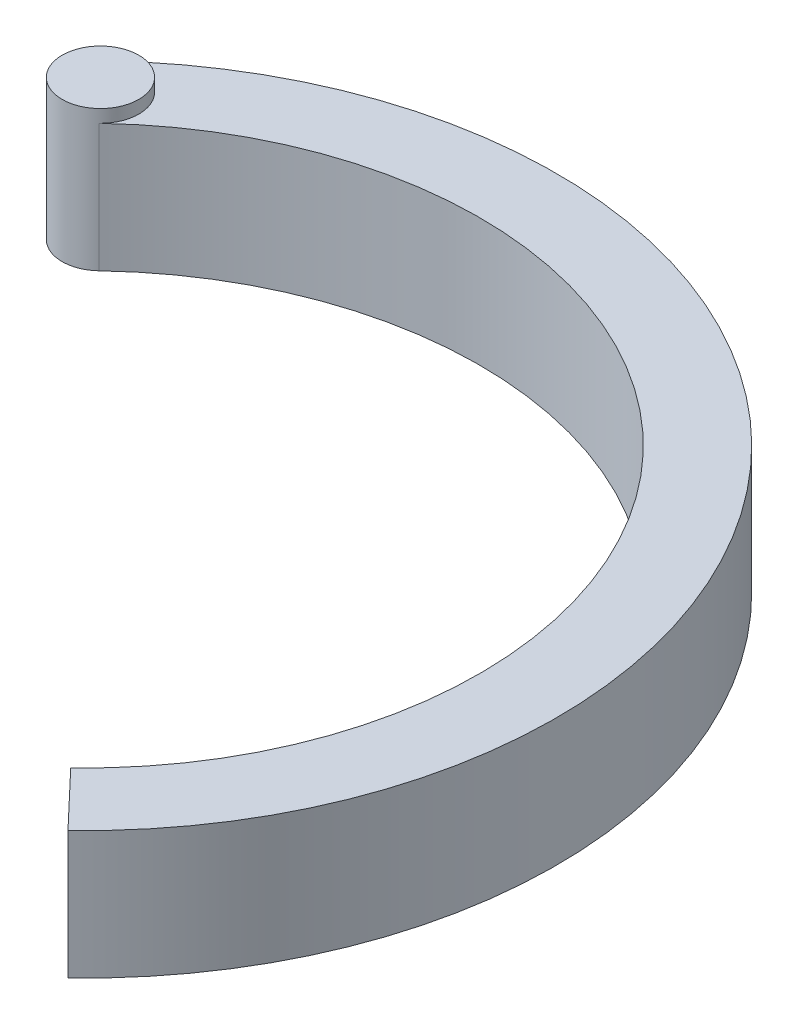
from build123d import *

# Parameters (mm, degrees)
BOSS_EXTRUDE8_DEPTH     = 10
SKETCH17_R              = 3
BOSS_EXTRUDE9_DEPTH     = 1
CUT_EXTRUDE3_DEPTH      = 48
CUT_EXTRUDE3_DEPTH_BACK = 52


with BuildPart() as part:
    # Sketch15 → Boss-Extrude8 (new body)
    with BuildSketch(Plane(origin=(0, 0, 0), x_dir=(1, 0, 0), z_dir=(0, 1, 0))):
        with BuildLine():
            ThreePointArc((48.786503152, -51.330803164), (50.112545273, 0.848485663), (-2.066743554, 2.174527784))
            ThreePointArc((-2.066743554, 2.174527784), (-2.174527784, -2.066743554), (2.066743554, -2.174527784))
            ThreePointArc((2.066743554, -2.174527784), (45.763489705, -3.285001446), (44.653016043, -46.981747597))
            ThreePointArc((44.653016043, -46.981747597), (44.545231814, -51.223018935), (48.786503152, -51.330803164))
        make_face()
    extrude(amount=BOSS_EXTRUDE8_DEPTH)

    # Sketch17 → Boss-Extrude9 (add)
    with BuildSketch(Plane(origin=(0, 10, 0), x_dir=(1, 0, 0), z_dir=(0, 1, 0))):
        with Locations(Location((0, 0, 0), (0, 0, 133.544244871))):
            Circle(SKETCH17_R)
    extrude(amount=BOSS_EXTRUDE9_DEPTH)

    # Sketch18 → Cut-Extrude3 (cut, two sides: drawn at the far end of the back side and taken through both)
    with BuildSketch(Plane(origin=(0, 10, 0), x_dir=(1, 0, 0), z_dir=(0, 1, 0)).offset(-CUT_EXTRUDE3_DEPTH_BACK)):
        with BuildLine():
            Line((44.653016043, -46.981747597), (48.786503152, -51.330803164))
            ThreePointArc((48.786503152, -51.330803164), (46.643544638, -52.155307104), (44.545231814, -51.223018935))
            ThreePointArc((44.545231814, -51.223018935), (43.720727874, -49.080060421), (44.653016043, -46.981747597))
        make_face()
    extrude(amount=CUT_EXTRUDE3_DEPTH + CUT_EXTRUDE3_DEPTH_BACK, mode=Mode.SUBTRACT)


solid = part.part
